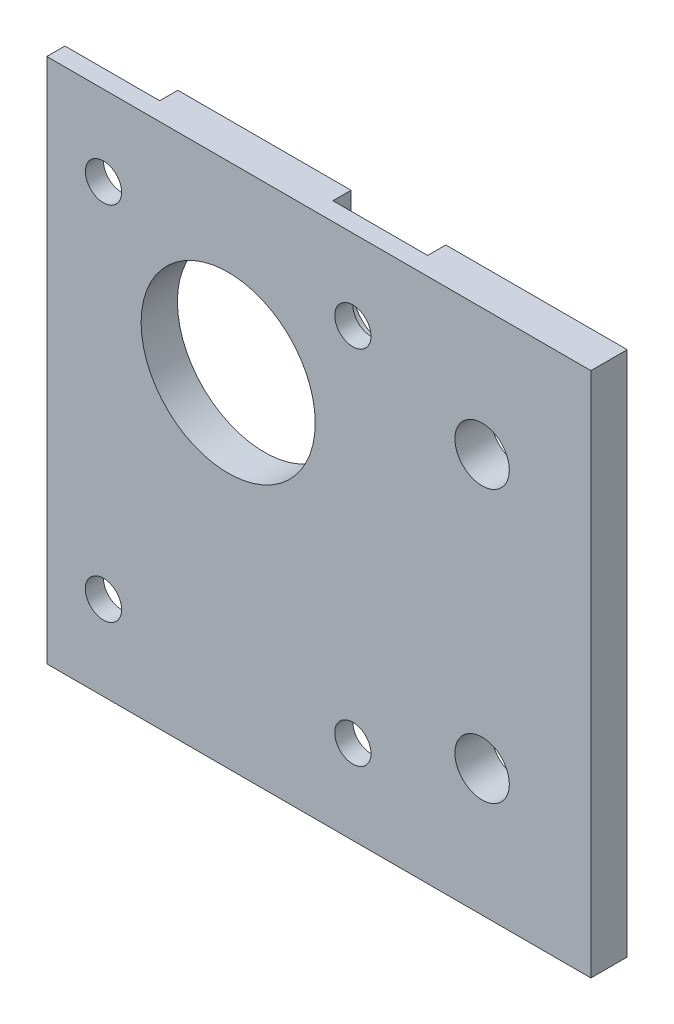
from build123d import *

# Parameters (mm, degrees)
SKETCH1_R           = 9.6
SKETCH1_R_2         = 4.2
BOSS_EXTRUDE1_DEPTH = 2
SKETCH4_W           = 60
SKETCH4_H           = 58
SKETCH4_R           = 2
SKETCH4_R_2         = 9.6
BOSS_EXTRUDE3_DEPTH = 2
SKETCH5_R           = 3
CUT_EXTRUDE1_DEPTH  = 4


with BuildPart() as part:
    # Sketch1 → Boss-Extrude1 (new body)
    with BuildSketch(Plane.XY):
        with BuildLine():
            Line((40, 29), (20, 29))
            Line((20, 29), (20, 15.95))
            Line((20, 15.95), (13.75, 15.95))
            ThreePointArc((13.75, 15.95), (10.780151519, 17.180151519), (9.55, 20.15))
            Line((9.55, 20.15), (9.55, 29))
            Line((9.55, 29), (-9.55, 29))
            Line((-9.55, 29), (-9.55, 20.15))
            ThreePointArc((-9.55, 20.15), (-10.780151519, 17.180151519), (-13.75, 15.95))
            Line((-13.75, 15.95), (-20, 15.95))
            Line((-20, 15.95), (-20, -16.278610808))
            Line((-20, -16.278610808), (-16.186, -16.278610808))
            Line((-16.186, -16.278610808), (-12.112917629, -13.378610808))
            ThreePointArc((-12.112917629, -13.378610808), (-6.255528438, -14.364), (-7.240917629, -20.221389192))
            Line((-7.240917629, -20.221389192), (-11.314, -23.121389192))
            Line((-11.314, -23.121389192), (-11.314, -29))
            Line((-11.314, -29), (9.55, -29))
            Line((9.55, -29), (9.55, -19.7))
            ThreePointArc((9.55, -19.7), (10.780151519, -16.730151519), (13.75, -15.5))
            Line((13.75, -15.5), (20, -15.5))
            Line((20, -15.5), (20, -29))
            Line((20, -29), (40, -29))
            Line((40, -29), (40, 29))
        make_face()
        with Locations((0, 8.8)):
            Circle(SKETCH1_R, mode=Mode.SUBTRACT)
        with Locations((-5.725, -6.1)):
            Circle(SKETCH1_R_2, mode=Mode.SUBTRACT)
        with Locations((5.725, -6.1)):
            Circle(SKETCH1_R_2, mode=Mode.SUBTRACT)
    extrude(amount=BOSS_EXTRUDE1_DEPTH)

    # Sketch4 → Boss-Extrude3 (add)
    with BuildSketch(Plane.XY.offset(2)):
        with Locations((10, 0)):
            Rectangle(SKETCH4_W, SKETCH4_H)
        with Locations((13.75, -19.7)):
            Circle(SKETCH4_R, mode=Mode.SUBTRACT)
        with Locations((-13.75, 20.15)):
            Circle(SKETCH4_R, mode=Mode.SUBTRACT)
        with Locations((13.75, 20.15)):
            Circle(SKETCH4_R, mode=Mode.SUBTRACT)
        with Locations((-13.75, -19.7)):
            Circle(SKETCH4_R, mode=Mode.SUBTRACT)
        with Locations((0, 8.8)):
            Circle(SKETCH4_R_2, mode=Mode.SUBTRACT)
    extrude(amount=BOSS_EXTRUDE3_DEPTH)

    # Sketch5 → Cut-Extrude1 (cut)
    with BuildSketch(Plane.XY.offset(4)):
        with Locations((28, 15)):
            Circle(SKETCH5_R)
        with Locations((28, -15)):
            Circle(SKETCH5_R)
    extrude(amount=-CUT_EXTRUDE1_DEPTH, mode=Mode.SUBTRACT)


solid = part.part
